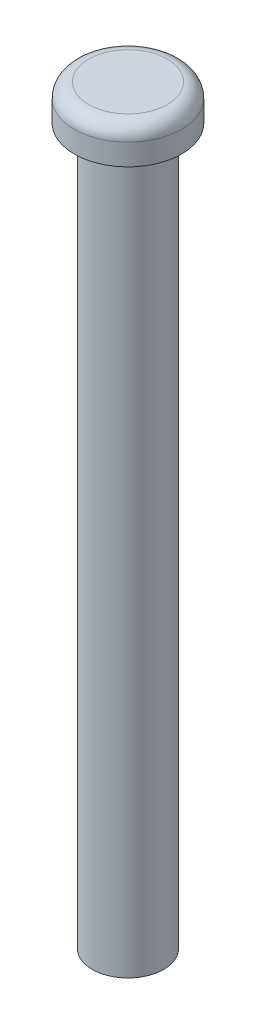
from build123d import *

# Parameters (mm, degrees)
SKETCH1_R           = 5
BOSS_EXTRUDE1_DEPTH = 100
SKETCH2_R           = 7.5
BOSS_EXTRUDE2_DEPTH = 5
FILLET1_R           = 2


with BuildPart() as part:
    # Sketch1 → Boss-Extrude1 (new body)
    with BuildSketch(Plane(origin=(0, 0, 0), x_dir=(1, 0, 0), z_dir=(0, 1, 0))):
        with Locations(Location((0, 0, 0), (0, 0, 270))):
            Circle(SKETCH1_R)
    extrude(amount=BOSS_EXTRUDE1_DEPTH)

    # Sketch2 → Boss-Extrude2 (add)
    with BuildSketch(Plane(origin=(0, 100, 0), x_dir=(1, 0, 0), z_dir=(0, 1, 0))):
        with Locations(Location((0, 0, 0), (0, 0, 270))):
            Circle(SKETCH2_R)
    extrude(amount=BOSS_EXTRUDE2_DEPTH)

    # Fillet1
    fillet1_edges = [part.edges().sort_by_distance(p)[0] for p in [
        (0, 105, -7.5),
    ]]
    fillet(fillet1_edges, radius=FILLET1_R)


solid = part.part
